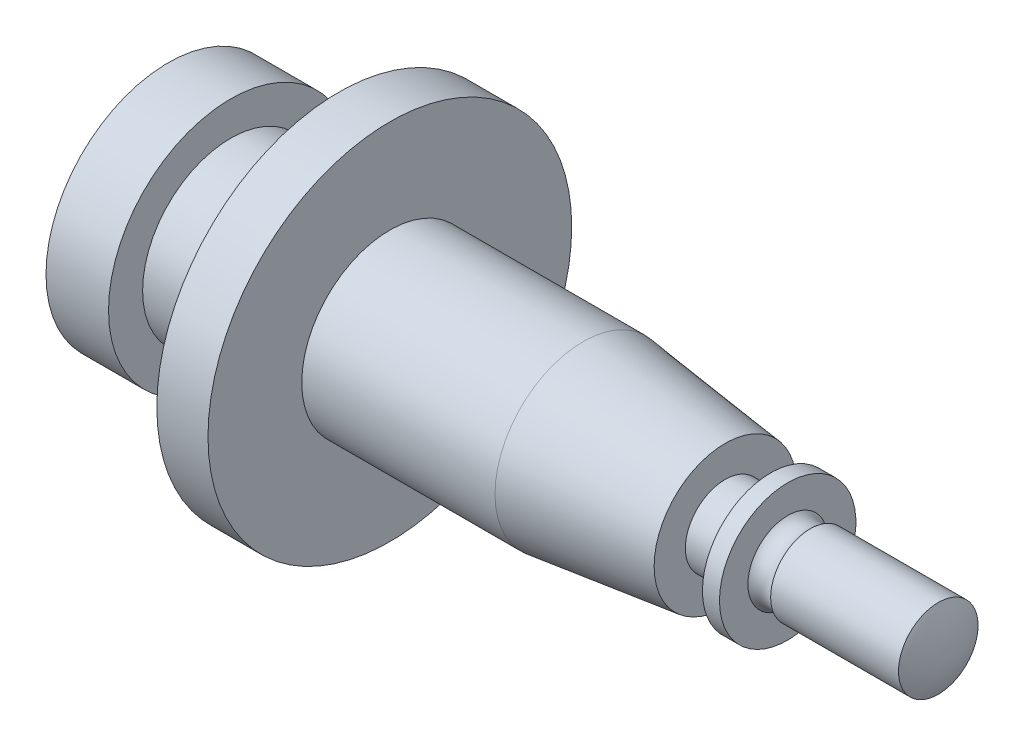
from build123d import *


with BuildPart() as part:
    # Çizim1 → Döndür2 (revolve)
    with BuildSketch(Plane.XY, mode=Mode.PRIVATE) as d_nd_r2_sk:
        with BuildLine():
            Line((0, 0), (0, 21.5))
            Line((0, 21.5), (11, 21.5))
            Line((11, 21.5), (11, 15.5))
            Line((11, 15.5), (30, 15.5))
            Line((30, 15.5), (30, 32))
            Line((30, 32), (39, 32))
            Line((39, 32), (39, 15.5))
            Line((39, 15.5), (73, 15.5))
            Line((73, 15.5), (98, 12.5))
            Line((98, 12.5), (98, 7))
            Line((98, 7), (106, 7))
            Line((106, 7), (106, 12))
            Line((106, 12), (109, 12))
            Line((109, 12), (109, 7))
            ThreePointArc((109, 7), (111, 6.236067977), (113, 7))
            Line((113, 7), (135.5, 7))
            ThreePointArc((135.5, 7), (136.673723702, 3.590797936), (137, 0))
            Line((137, 0), (0, 0))
        make_face()
    revolve(d_nd_r2_sk.sketch.rotate(Axis((0, 0, 0), (1, 0, 0)), 90), axis=Axis((0, 0, 0), (1, 0, 0)))


solid = part.part
